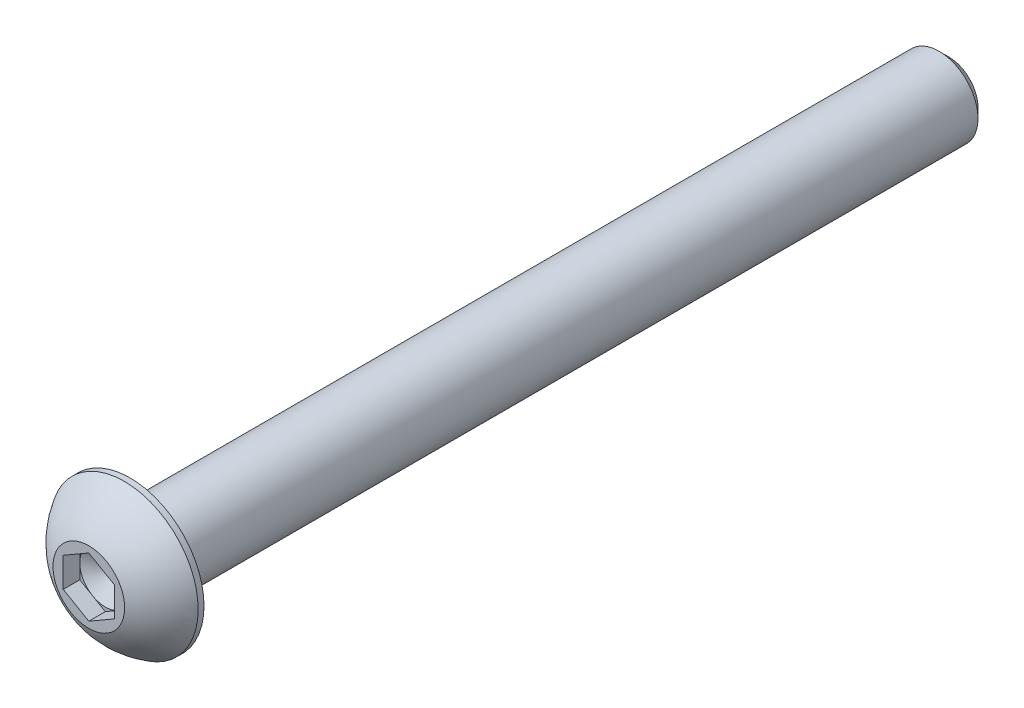
from build123d import *

# Parameters (mm, degrees)
CUT_EXTRUDE1_START = 25.65654
CUT_EXTRUDE1_DEPTH = 2.802619264


with BuildPart() as part:
    # Sketch2 → Revolve1 (revolve)
    with BuildSketch(Plane(origin=(0, 0, 0), x_dir=(0, 0, -1), z_dir=(1, 0, 0)), mode=Mode.PRIVATE) as revolve1_sk:
        with BuildLine():
            Line((-26.6827, 1.5875), (-26.6827, 2.2225))
            ThreePointArc((-26.6827, 2.2225), (-25.767752118, 3.57733025), (-24.480157143, 4.5847))
            Line((-24.480157143, 4.5847), (-24.1173, 4.5847))
            Line((-24.1173, 4.5847), (-24.1173, 2.413))
            Line((-24.1173, 2.413), (26.0873875, 2.413))
            Line((26.0873875, 2.413), (26.6827, 1.8176875))
            Line((26.6827, 1.8176875), (26.6827, 0))
            Line((26.6827, 0), (-24.739996448, 0))
            Line((-24.739996448, 0), (-25.65654, 1.5875))
            Line((-25.65654, 1.5875), (-26.6827, 1.5875))
        make_face()
    revolve(revolve1_sk.sketch.rotate(Axis((0, 0, 26.6827), (0, 0, -1)), 90), axis=Axis((0, 0, 26.6827), (0, 0, -1)))

    # Sketch3 → Cut-Extrude1 (cut, through all)
    with BuildSketch(Plane.XY.offset(CUT_EXTRUDE1_START)):
        Polygon((0, 1.833087105), (-1.5875, 0.916543552), (-1.5875, -0.916543552), (0, -1.833087105), (1.5875, -0.916543552), (1.5875, 0.916543552), align=None)
    extrude(amount=CUT_EXTRUDE1_DEPTH, mode=Mode.SUBTRACT)


solid = part.part
